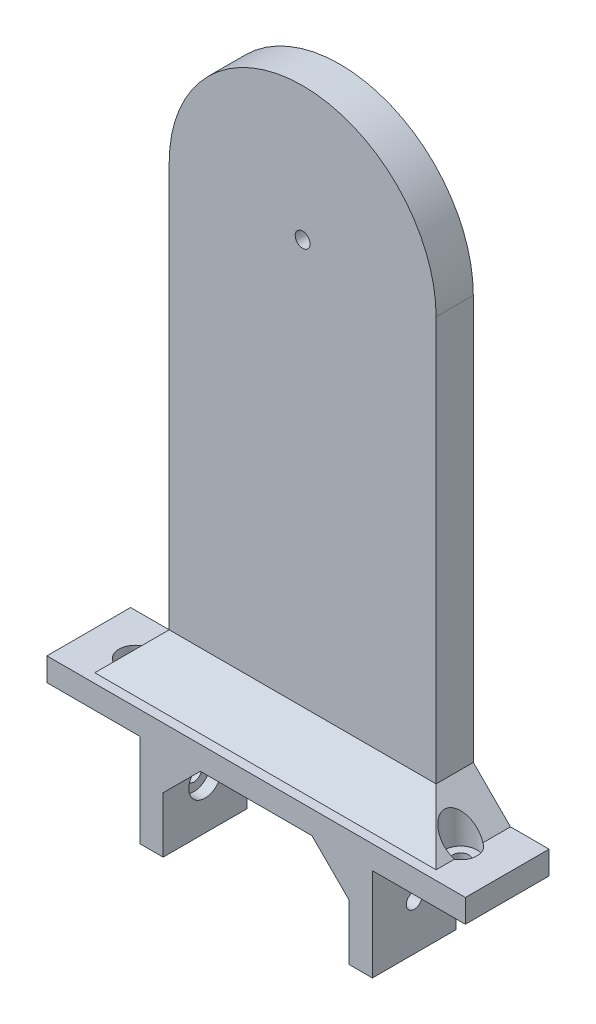
from build123d import *

# Parameters (mm, degrees)
RESSALTO_EXTRUS_O1_DEPTH                     = 8
RESSALTO_EXTRUS_O2_DEPTH                     = 10
CHANFRO1_SIZE                                = 8
ESBO_O3_R                                    = 1.6
CORTE_EXTRUS_O1_DEPTH                        = 138.523416188
REBAIXO_PARA_PARAFUSO_COM_CABE_A_PAN_2_COUNT = 2
REBAIXO_PARA_PARAFUSO_COM_CABE_A_PAN_2_PITCH = 70
CORTE_EXTRUS_O3_REACH                        = 134.856
ESBO_O11_R                                   = 3.5
CORTE_EXTRUS_O4_START                        = 2
ESBO_O19_R                                   = 3.5
CORTE_EXTRUS_O4_DEPTH                        = 2


with BuildPart() as part:
    # Esboço1 → Ressalto-extrusão1 (new body)
    with BuildSketch(Plane.XY):
        with BuildLine():
            Line((-20, -20), (-20, 0))
            Line((-20, 0), (20, 0))
            Line((20, 0), (20, -20))
            Line((20, -20), (25, -20))
            Line((25, -20), (25, 0))
            Line((25, 0), (45, 0))
            Line((45, 0), (45, 5))
            Line((45, 5), (28.7, 5))
            Line((28.7, 5), (28.7, 100))
            ThreePointArc((28.7, 100), (0, 128.7), (-28.7, 100))
            Line((-28.7, 100), (-28.7, 5))
            Line((-28.7, 5), (-45, 5))
            Line((-45, 5), (-45, 0))
            Line((-45, 0), (-25, 0))
            Line((-25, 0), (-25, -20))
            Line((-25, -20), (-20, -20))
        make_face()
    extrude(amount=RESSALTO_EXTRUS_O1_DEPTH)

    # Esboço2 → Ressalto-extrusão2 (add)
    with BuildSketch(Plane.XY.offset(8)):
        Polygon((-20, -20), (-25, -20), (-25, 0), (-45, 0), (-45, 5), (45, 5), (45, 0), (25, 0), (25, -20), (20, -20), (20, 0), (-20, 0), align=None)
    extrude(amount=RESSALTO_EXTRUS_O2_DEPTH)

    # Chanfro1
    chanfro1_edges = [part.edges().sort_by_distance(p)[0] for p in [
        (28.7, 5, 4),
        (-28.7, 5, 4),
        (0, 5, 8),
        (20, 0, 9),
        (-20, 0, 9),
    ]]
    chamfer(chanfro1_edges, length=CHANFRO1_SIZE)

    # Esboço3 → Corte-extrusão1 (cut, through all)
    with BuildSketch(Plane(origin=(0, 0, 0), x_dir=(-1, 0, 0), z_dir=(0, 0, -1))):
        with Locations((0, 100)):
            Circle(ESBO_O3_R)
    extrude(amount=-CORTE_EXTRUS_O1_DEPTH, mode=Mode.SUBTRACT)

    # Esboço10 → Rebaixo para parafuso com cabe_a panela (revolve, cut)
    with BuildSketch(Plane(origin=(-35, 5, 9), x_dir=(0, 0, 1), z_dir=(1, 0, 0))):
        Polygon((0, 0), (0, 7.021463052), (1.7, 6), (1.7, 2.4), (3.5, 2.4), (3.5, 0), align=None)
    rebaixo_para_parafuso_com_cabe_a_panela = revolve(axis=Axis((-35, 11.35, 9), (0, -1, 0)), mode=Mode.SUBTRACT)

    # Rebaixo para parafuso com cabe_a pan 2: Rebaixo para parafuso com cabe_a panela ×2
    with Locations(*[(i * REBAIXO_PARA_PARAFUSO_COM_CABE_A_PAN_2_PITCH, 0, 0) for i in range(1, REBAIXO_PARA_PARAFUSO_COM_CABE_A_PAN_2_COUNT)]):
        add(rebaixo_para_parafuso_com_cabe_a_panela, mode=Mode.SUBTRACT)

    # Corte-extrusão3: up to this face of the body (flat: up to its plane)
    corte_extrus_o3_end = Plane(part.part.faces().sort_by_distance((33.144444444, 8.555555556, 6.222222222))[0])
    # Esboço11 → Corte-extrusão3 (cut, up to the picked face)
    with BuildSketch(Plane(origin=(0, 5, 0), x_dir=(1, 0, 0), z_dir=(0, 1, 0)), mode=Mode.PRIVATE) as corte_extrus_o3_sk1:
        with Locations((35, -9)):
            Circle(ESBO_O11_R)
    corte_extrus_o3_tool1 = split(extrude(corte_extrus_o3_sk1.sketch, amount=CORTE_EXTRUS_O3_REACH, mode=Mode.PRIVATE), bisect_by=corte_extrus_o3_end, keep=Keep.BOTH, mode=Mode.PRIVATE)
    # Esboço11 → Corte-extrusão3 (cut, up to the picked face)
    with BuildSketch(Plane(origin=(0, 5, 0), x_dir=(1, 0, 0), z_dir=(0, 1, 0)), mode=Mode.PRIVATE) as corte_extrus_o3_sk2:
        with Locations((-35, -9)):
            Circle(ESBO_O11_R)
    corte_extrus_o3_tool2 = split(extrude(corte_extrus_o3_sk2.sketch, amount=CORTE_EXTRUS_O3_REACH, mode=Mode.PRIVATE), bisect_by=corte_extrus_o3_end, keep=Keep.BOTH, mode=Mode.PRIVATE)
    add(corte_extrus_o3_tool1.solids().sort_by(Axis((35, 5, 9), (0, 1, 0)))[0], mode=Mode.SUBTRACT)
    add(corte_extrus_o3_tool2.solids().sort_by(Axis((-35, 5, 9), (0, 1, 0)))[0], mode=Mode.SUBTRACT)

    # Esboço18 → Rebaixo para parafuso com cabe_a pan 3 (revolve, cut)
    with BuildSketch(Plane(origin=(20, -10, 9), x_dir=(0, 0, 1), z_dir=(0, 1, 0))):
        Polygon((0, 0), (0, 7.021463052), (1.7, 6), (1.7, 2.4), (3.5, 2.4), (3.5, 0), align=None)
    revolve(axis=Axis((13.65, -10, 9), (1, 0, 0)), mode=Mode.SUBTRACT)

    # Esboço19 → Corte-extrusão4 (cut)
    with BuildSketch(Plane.ZY.offset(-20).offset(CORTE_EXTRUS_O4_START)):
        with Locations((9, -10)):
            Circle(ESBO_O19_R)
    corte_extrus_o4 = extrude(amount=-CORTE_EXTRUS_O4_DEPTH, mode=Mode.SUBTRACT)

    # Esboço21 → Rebaixo para parafuso com cabe_a pan 4 (revolve, cut)
    with BuildSketch(Plane(origin=(-20, -10, 9), x_dir=(0, 0, -1), z_dir=(0, 1, 0))):
        Polygon((0, 0), (0, 7.021463052), (1.7, 6), (1.7, 2.4), (3.5, 2.4), (3.5, 0), align=None)
    revolve(axis=Axis((-13.65, -10, 9), (-1, 0, 0)), mode=Mode.SUBTRACT)

    # Espelhar1: Corte-extrusão4 across plane
    add(corte_extrus_o4.mirror(Plane(origin=(0, 0, 0), x_dir=(0, 0, 1), z_dir=(1, 0, 0))), mode=Mode.SUBTRACT)


solid = part.part
